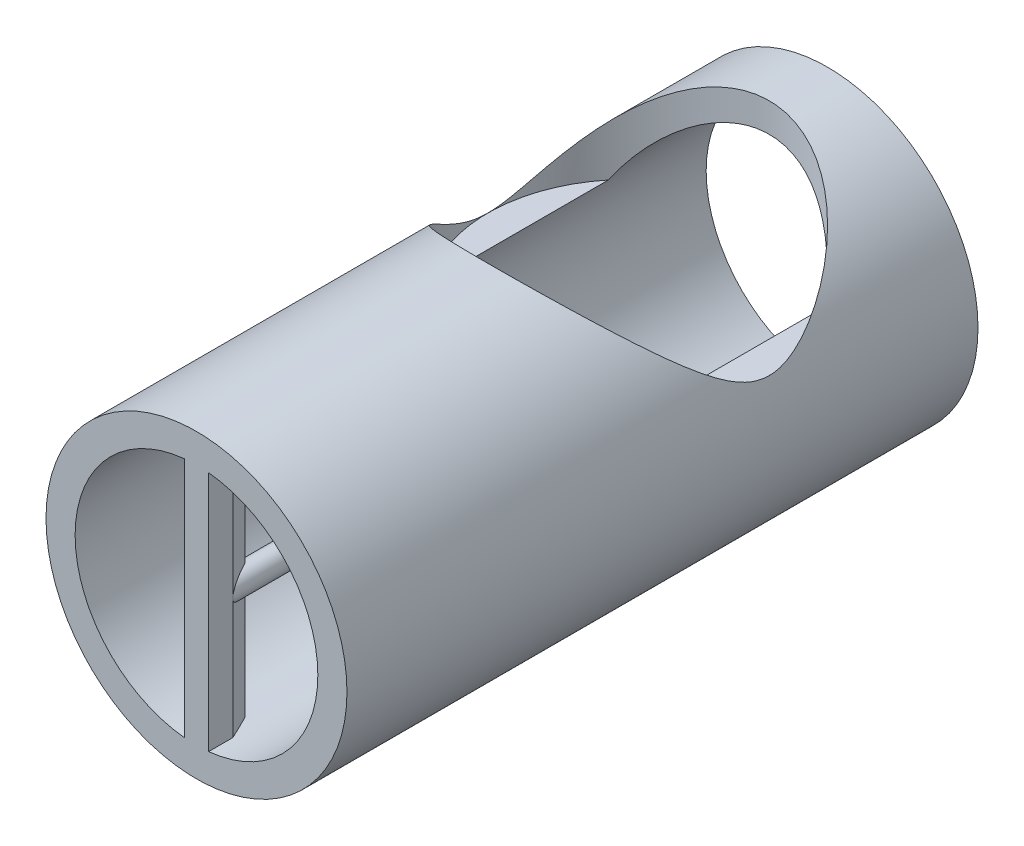
from build123d import *

# Parameters (mm, degrees)
CROQUIS1_R                               = 31
CROQUIS1_R_2                             = 25
SALIENTE_EXTRUIR1_DEPTH                  = 130
CROQUIS3_R                               = 29
CORTAR_EXTRUIR1_DEPTH                    = 29.05
SALIENTE_EXTRUIR2_REACH                  = 139.193
SALIENTE_EXTRUIR2_END_RADIUS             = 25
SALIENTE_EXTRUIR2_DIRECTION_2_REACH      = 139.193
SALIENTE_EXTRUIR2_DIRECTION_2_END_RADIUS = 25
CROQUIS6_R                               = 2.5
SALIENTE_EXTRUIR3_DEPTH                  = 20


with BuildPart() as part:
    # Croquis1 → Saliente-Extruir1 (new body)
    with BuildSketch(Plane.XY):
        Circle(CROQUIS1_R)
        Circle(CROQUIS1_R_2, mode=Mode.SUBTRACT)
    extrude(amount=SALIENTE_EXTRUIR1_DEPTH)

    # Croquis3 → Cortar-Extruir1 (cut)
    with BuildSketch(Plane(origin=(0, 40, 0), x_dir=(1, 0, 0), z_dir=(0, 1, 0))):
        with Locations(Location((0, -41, 0), (0, 0, 270))):
            Circle(CROQUIS3_R)
    extrude(amount=-CORTAR_EXTRUIR1_DEPTH, mode=Mode.SUBTRACT)

    # Saliente-Extruir2: up to this cylinder (the profile starts inside it)
    saliente_extruir2_end = Plane(origin=(0, 0, 126.111111), z_dir=(0, 0, -1)) * Cylinder(SALIENTE_EXTRUIR2_END_RADIUS, 329.386, mode=Mode.PRIVATE)
    # Croquis5 → Saliente-Extruir2 (add, up to the surface)
    with BuildSketch(Plane(origin=(0, 0, 0), x_dir=(1, 0, 0), z_dir=(0, 1, 0)), mode=Mode.PRIVATE) as saliente_extruir2_sk1:
        Polygon((-2.5, -130), (2.5, -130), (2.5, -125), (0, -120), (-2.5, -125), align=None)
    saliente_extruir2_tool1 = extrude(saliente_extruir2_sk1.sketch, amount=SALIENTE_EXTRUIR2_REACH, mode=Mode.PRIVATE) & saliente_extruir2_end
    add(saliente_extruir2_tool1.solids().sort_by_distance((0, 0, 126.111111))[0])

    # Saliente-Extruir2 direction 2: up to this cylinder (the profile starts inside it)
    saliente_extruir2_direction_2_end = Plane(origin=(0, 0, 126.111111), z_dir=(0, 0, -1)) * Cylinder(SALIENTE_EXTRUIR2_DIRECTION_2_END_RADIUS, 329.386, mode=Mode.PRIVATE)
    # Croquis5 → Saliente-Extruir2 direction 2 (add, up to the surface)
    with BuildSketch(Plane(origin=(0, 0, 0), x_dir=(1, 0, 0), z_dir=(0, 1, 0)), mode=Mode.PRIVATE) as saliente_extruir2_direction_2_sk1:
        Polygon((-2.5, -130), (2.5, -130), (2.5, -125), (0, -120), (-2.5, -125), align=None)
    saliente_extruir2_direction_2_tool1 = extrude(saliente_extruir2_direction_2_sk1.sketch, amount=-SALIENTE_EXTRUIR2_DIRECTION_2_REACH, mode=Mode.PRIVATE) & saliente_extruir2_direction_2_end
    add(saliente_extruir2_direction_2_tool1.solids().sort_by_distance((0, 0, 126.111111))[0])

    # Croquis6 → Saliente-Extruir3 (add)
    with BuildSketch(Plane.XY.offset(130)):
        Circle(CROQUIS6_R)
    extrude(amount=-SALIENTE_EXTRUIR3_DEPTH)


solid = part.part
